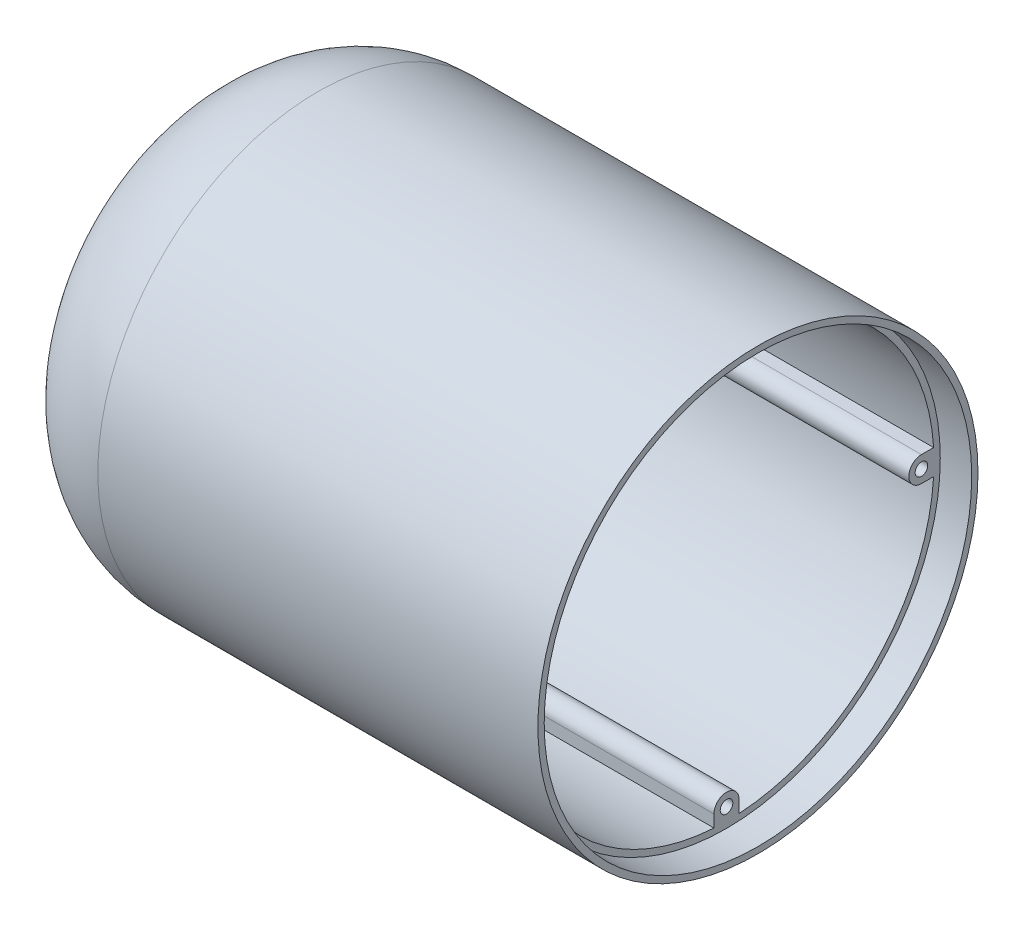
from build123d import *

# Parameters (mm, degrees)
THICKEN1_T2                     = 2
SURFACE_EXTRUDE1_2_DEPTH        = 65
THICKEN2_T1                     = 2
BOSS_EXTRUDE2_REACH             = 83.701
BOSS_EXTRUDE2_END_MAJOR_RADIUS  = 15
BOSS_EXTRUDE2_END_MINOR_RADIUS  = 18
BOSS_EXTRUDE2_DIRECTION_2_DEPTH = 65
SKETCH5_R                       = 1
CUT_EXTRUDE2_DEPTH              = 65
SURFACE_EXTRUDE2_3_DEPTH        = 5
THICKEN3_T1                     = 1
SKETCH7_R                       = 5
CUT_EXTRUDE3_DEPTH              = 2


with BuildPart() as body_1:
    # Surface-Revolve1: a surface, the sketch's curves turned about an axis
    with BuildLine(Plane(origin=(0, 0, 0), x_dir=(1, 0, 0), z_dir=(0, 1, 0)), mode=Mode.PRIVATE) as surface_revolve1_1_path:
        Line((0, 0), (0, 15))
        ThreePointArc((0, 15), (5.857864376, 29.142135624), (20, 35))
    surface_revolve1_1 = Shell.revolve(surface_revolve1_1_path.wire(), 360, Axis((0, 0, 0), (1, 0, 0)))
    add(Solid.thicken(surface_revolve1_1, -THICKEN1_T2))

    # Surface-Extrude1: a surface, the sketch's curves swept straight by 65 mm
    with BuildLine(Plane(origin=(20, 0, 0), x_dir=(0, 0, -1), z_dir=(1, 0, 0)), mode=Mode.PRIVATE) as surface_extrude1_2_path:
        CenterArc((0, 0), 35, 0, 360)
    surface_extrude1_2 = Shell.extrude(surface_extrude1_2_path.wire(), (1 * SURFACE_EXTRUDE1_2_DEPTH, 0 * SURFACE_EXTRUDE1_2_DEPTH, 0 * SURFACE_EXTRUDE1_2_DEPTH))
    add(Solid.thicken(surface_extrude1_2, THICKEN2_T1))

    # Boss-Extrude2: up to this torus (the profile starts inside it)
    boss_extrude2_end = Plane(origin=(20, 0, 0), z_dir=(1, 0, 0)) * Torus(BOSS_EXTRUDE2_END_MAJOR_RADIUS, BOSS_EXTRUDE2_END_MINOR_RADIUS, mode=Mode.PRIVATE)
    # Sketch2 → Boss-Extrude2 (add, up to the surface)
    with BuildSketch(Plane(origin=(20, 0, 0), x_dir=(0, 0, -1), z_dir=(1, 0, 0)), mode=Mode.PRIVATE) as boss_extrude2_sk1:
        with BuildLine():
            Line((-2, 31), (-2, 33))
            Line((-2, 33), (2, 33))
            Line((2, 33), (2, 31))
            ThreePointArc((2, 31), (0, 29), (-2, 31))
        make_face()
    boss_extrude2_tool1 = extrude(boss_extrude2_sk1.sketch, amount=-BOSS_EXTRUDE2_REACH, mode=Mode.PRIVATE) & boss_extrude2_end
    add(boss_extrude2_tool1.solids().sort_by_distance((20, 31.1867, 0))[0])
    # Sketch2 → Boss-Extrude2 (add, up to the surface)
    with BuildSketch(Plane(origin=(20, 0, 0), x_dir=(0, 0, -1), z_dir=(1, 0, 0)), mode=Mode.PRIVATE) as boss_extrude2_sk2:
        with BuildLine():
            Line((-31, -2), (-33, -2))
            Line((-33, -2), (-33, 2))
            Line((-33, 2), (-31, 2))
            ThreePointArc((-31, 2), (-29, 0), (-31, -2))
        make_face()
    boss_extrude2_tool2 = extrude(boss_extrude2_sk2.sketch, amount=-BOSS_EXTRUDE2_REACH, mode=Mode.PRIVATE) & boss_extrude2_end
    add(boss_extrude2_tool2.solids().sort_by_distance((20, 0, 31.1867))[0])
    # Sketch2 → Boss-Extrude2 (add, up to the surface)
    with BuildSketch(Plane(origin=(20, 0, 0), x_dir=(0, 0, -1), z_dir=(1, 0, 0)), mode=Mode.PRIVATE) as boss_extrude2_sk3:
        with BuildLine():
            Line((2, -33), (2, -31))
            ThreePointArc((2, -31), (0, -29), (-2, -31))
            Line((-2, -31), (-2, -33))
            Line((-2, -33), (2, -33))
        make_face()
    boss_extrude2_tool3 = extrude(boss_extrude2_sk3.sketch, amount=-BOSS_EXTRUDE2_REACH, mode=Mode.PRIVATE) & boss_extrude2_end
    add(boss_extrude2_tool3.solids().sort_by_distance((20, -31.1867, 0))[0])
    # Sketch2 → Boss-Extrude2 (add, up to the surface)
    with BuildSketch(Plane(origin=(20, 0, 0), x_dir=(0, 0, -1), z_dir=(1, 0, 0)), mode=Mode.PRIVATE) as boss_extrude2_sk4:
        with BuildLine():
            Line((33, 2), (31, 2))
            ThreePointArc((31, 2), (29, 0), (31, -2))
            Line((31, -2), (33, -2))
            Line((33, -2), (33, 2))
        make_face()
    boss_extrude2_tool4 = extrude(boss_extrude2_sk4.sketch, amount=-BOSS_EXTRUDE2_REACH, mode=Mode.PRIVATE) & boss_extrude2_end
    add(boss_extrude2_tool4.solids().sort_by_distance((20, 0, -31.1867))[0])

    # Sketch2 → Boss-Extrude2 direction 2 (add)
    with BuildSketch(Plane(origin=(20, 0, 0), x_dir=(0, 0, -1), z_dir=(1, 0, 0))):
        with BuildLine():
            Line((-2, 31), (-2, 33))
            Line((-2, 33), (2, 33))
            Line((2, 33), (2, 31))
            ThreePointArc((2, 31), (0, 29), (-2, 31))
        make_face()
        with BuildLine():
            Line((-31, -2), (-33, -2))
            Line((-33, -2), (-33, 2))
            Line((-33, 2), (-31, 2))
            ThreePointArc((-31, 2), (-29, 0), (-31, -2))
        make_face()
        with BuildLine():
            Line((2, -33), (2, -31))
            ThreePointArc((2, -31), (0, -29), (-2, -31))
            Line((-2, -31), (-2, -33))
            Line((-2, -33), (2, -33))
        make_face()
        with BuildLine():
            Line((33, 2), (31, 2))
            ThreePointArc((31, 2), (29, 0), (31, -2))
            Line((31, -2), (33, -2))
            Line((33, -2), (33, 2))
        make_face()
    extrude(amount=BOSS_EXTRUDE2_DIRECTION_2_DEPTH)

    # Sketch5 → Cut-Extrude2 (cut)
    with BuildSketch(Plane(origin=(85, 0, 0), x_dir=(0, 0, -1), z_dir=(1, 0, 0))):
        with Locations((0, 31)):
            Circle(SKETCH5_R)
        with Locations((31, 0)):
            Circle(SKETCH5_R)
        with Locations((-31, 0)):
            Circle(SKETCH5_R)
        with Locations((0, -31)):
            Circle(SKETCH5_R)
    extrude(amount=-CUT_EXTRUDE2_DEPTH, mode=Mode.SUBTRACT)

    # Surface-Extrude2: a surface, the sketch's curves swept straight by 5 mm
    with BuildLine(Plane(origin=(85, 0, 0), x_dir=(0, 0, -1), z_dir=(1, 0, 0)), mode=Mode.PRIVATE) as surface_extrude2_3_path:
        CenterArc((0, 0), 35, 0, 360)
    surface_extrude2_3 = Shell.extrude(surface_extrude2_3_path.wire(), (1 * SURFACE_EXTRUDE2_3_DEPTH, 0 * SURFACE_EXTRUDE2_3_DEPTH, 0 * SURFACE_EXTRUDE2_3_DEPTH))
    add(Solid.thicken(surface_extrude2_3, THICKEN3_T1))

    # Sketch7 → Cut-Extrude3 (cut)
    with BuildSketch(Plane(origin=(0, 0, 0), x_dir=(0, 0, -1), z_dir=(1, 0, 0))):
        with Locations(Location((0, 0, 0), (0, 0, 180))):
            Circle(SKETCH7_R)
    extrude(amount=CUT_EXTRUDE3_DEPTH, mode=Mode.SUBTRACT)


solid = body_1.part
